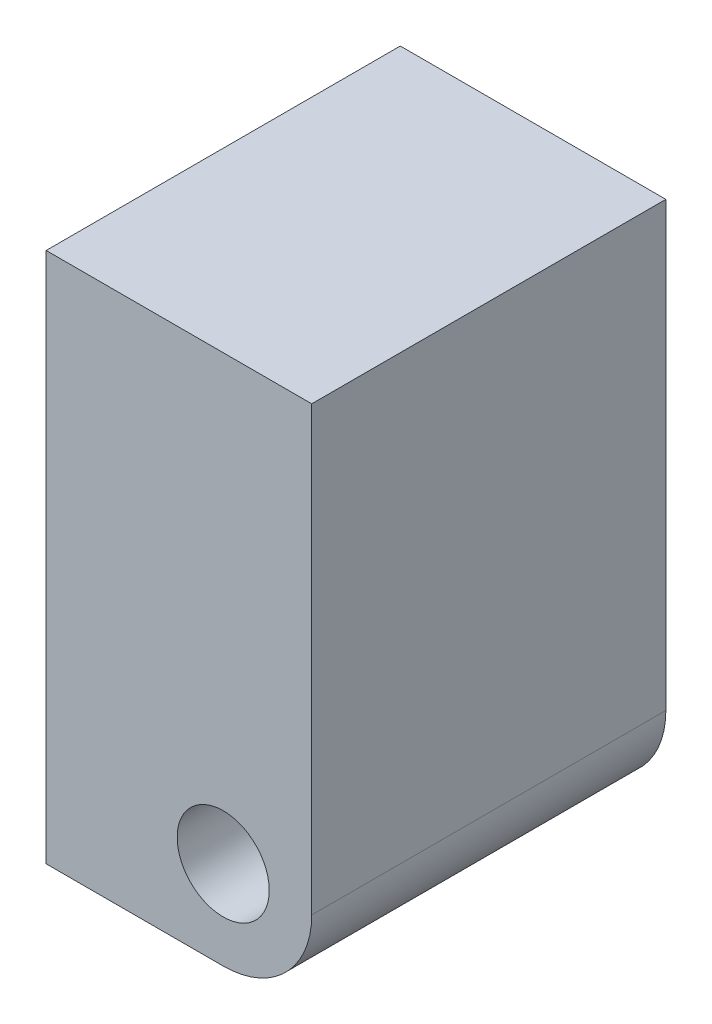
from build123d import *

# Parameters (mm, degrees)
CROQUIS2_R              = 2.6
SALIENTE_EXTRUIR2_DEPTH = 20


with BuildPart() as part:
    # Croquis2 → Saliente-Extruir2 (new body)
    with BuildSketch(Plane.XY):
        with BuildLine():
            Line((5, 0), (5, 25))
            Line((5, 25), (0, 25))
            Line((0, 25), (-10, 25))
            Line((-10, 25), (-10, -5))
            Line((-10, -5), (0, -5))
            ThreePointArc((0, -5), (3.535533906, -3.535533906), (5, 0))
        make_face()
        Circle(CROQUIS2_R, mode=Mode.SUBTRACT)
    extrude(amount=SALIENTE_EXTRUIR2_DEPTH)


solid = part.part
